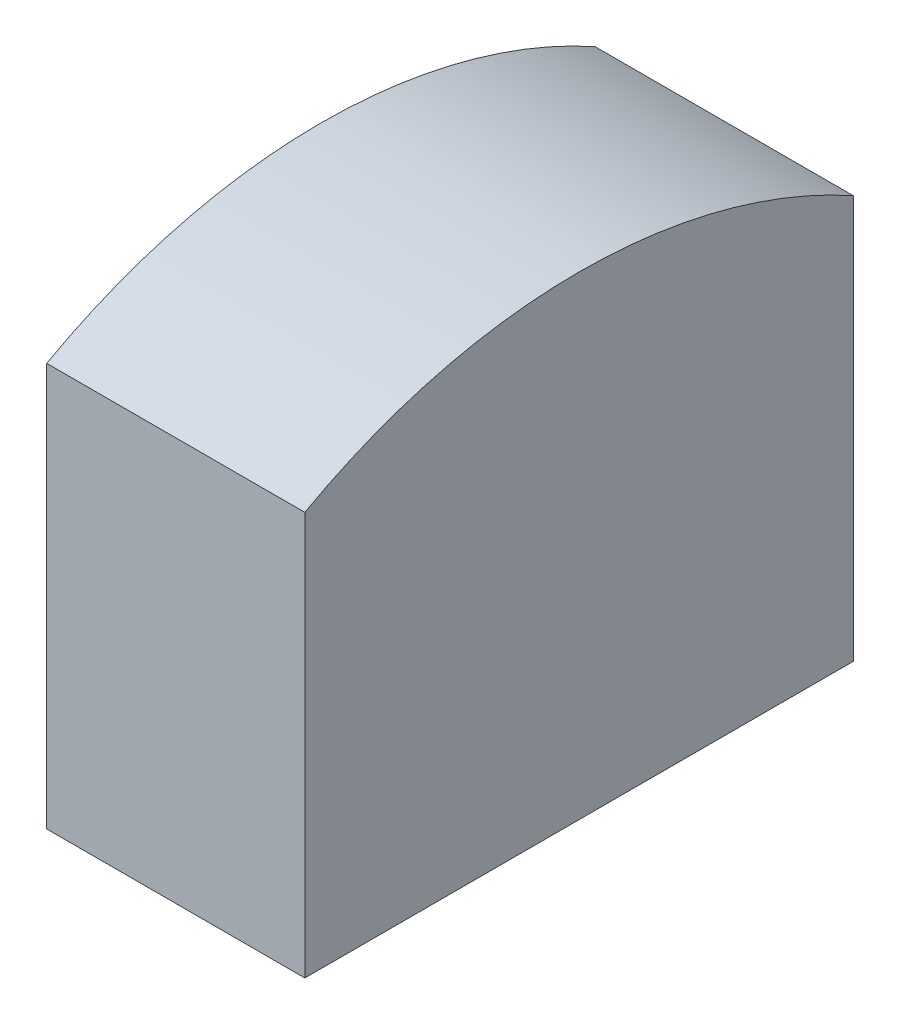
from build123d import *

# Parameters (mm, degrees)
SKETCH1_W                = 16
SKETCH1_H                = 34
BOSS_EXTRUDE1_DEPTH      = 25
BOSS_EXTRUDE2_DEPTH      = 16
M8_CLEARANCE_HOLE1_D     = 8.4
M8_CLEARANCE_HOLE1_DEPTH = 6
M8_CLEARANCE_HOLE1_TIP   = 2.5236146


with BuildPart() as part:
    # Sketch1 → Boss-Extrude1 (new body)
    with BuildSketch(Plane(origin=(0, 0, 0), x_dir=(1, 0, 0), z_dir=(0, 1, 0))):
        with Locations((8, 17)):
            Rectangle(SKETCH1_W, SKETCH1_H)
    extrude(amount=BOSS_EXTRUDE1_DEPTH)

    # Sketch2 → Boss-Extrude2 (add)
    with BuildSketch(Plane(origin=(16, 0, 0), x_dir=(0, 0, -1), z_dir=(1, 0, 0))):
        with BuildLine():
            Line((0, 25), (34, 25))
            ThreePointArc((34, 25), (17, 29.405882918), (0, 25))
        make_face()
    extrude(amount=-BOSS_EXTRUDE2_DEPTH)

    # M8 Clearance Hole1
    with Locations(Plane(origin=(0, 0, 0), x_dir=(-1, 0, 0), z_dir=(0, -1, 0))):
        with Locations((-8, 17)):
            Hole(M8_CLEARANCE_HOLE1_D / 2, depth=M8_CLEARANCE_HOLE1_DEPTH)
            with Locations((0, 0, -(M8_CLEARANCE_HOLE1_DEPTH + M8_CLEARANCE_HOLE1_TIP / 2))):  # 118° drill point
                Cone(0, M8_CLEARANCE_HOLE1_D / 2, M8_CLEARANCE_HOLE1_TIP, mode=Mode.SUBTRACT)


solid = part.part
